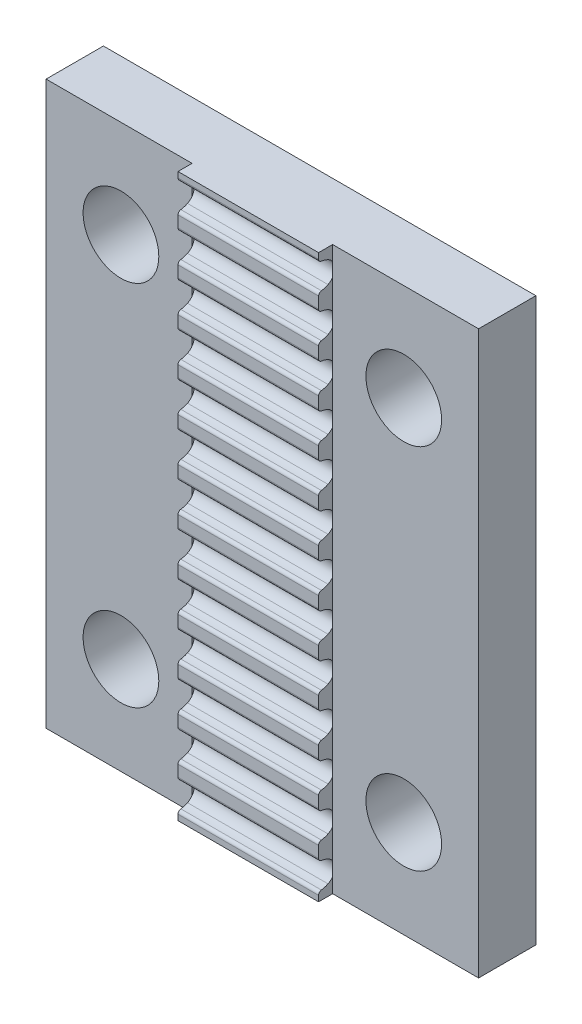
from build123d import *

# Parameters (mm, degrees)
SCHIZZO1_W                   = 6.75
SCHIZZO1_H                   = 26
SCHIZZO1_R                   = 1.75
SCHIZZO1_W_2                 = 6.5
ESTRUSIONE_ESTRUSIONE1_DEPTH = 1
SCHIZZO1_3_W                 = 6.5
SCHIZZO1_3_H                 = 26
ESTRUSIONE_ESTRUSIONE2_DEPTH = 1.65
ESTRUSIONE_ESTRUSIONE3_START = -1.65
SCHIZZO1_5_W                 = 6.75
SCHIZZO1_5_H                 = 26
SCHIZZO1_5_R                 = 1.75
SCHIZZO1_5_W_2               = 6.5
ESTRUSIONE_ESTRUSIONE3_DEPTH = 1.65
TAGLIO_ESTRUSIONE1_DEPTH     = 6.5


with BuildPart() as part:
    # Schizzo1 → Estrusione-Estrusione1 (new body)
    # profile 1 of 3: a face of its own
    with BuildSketch(Plane.XY):
        with Locations((-6.625, 0)):
            Rectangle(SCHIZZO1_W, SCHIZZO1_H)
        with Locations((-6.538461538, -8.5)):
            Circle(SCHIZZO1_R, mode=Mode.SUBTRACT)
        with Locations((-6.538461538, 8.5)):
            Circle(SCHIZZO1_R, mode=Mode.SUBTRACT)
    # profile 2 of 3: a face of its own
    with BuildSketch(Plane.XY):
        Rectangle(SCHIZZO1_W_2, SCHIZZO1_H)
    # profile 3 of 3: a face of its own
    with BuildSketch(Plane.XY):
        with Locations((6.625, 0)):
            Rectangle(SCHIZZO1_W, SCHIZZO1_H)
        with Locations((6.538461538, -8.5)):
            Circle(SCHIZZO1_R, mode=Mode.SUBTRACT)
        with Locations((6.538461538, 8.5)):
            Circle(SCHIZZO1_R, mode=Mode.SUBTRACT)
    extrude(amount=ESTRUSIONE_ESTRUSIONE1_DEPTH)

    # Schizzo1<3> → Estrusione-Estrusione2 (add)
    with BuildSketch(Plane.XY):
        Rectangle(SCHIZZO1_3_W, SCHIZZO1_3_H)
    extrude(amount=ESTRUSIONE_ESTRUSIONE2_DEPTH)

    # Schizzo1<5> → Estrusione-Estrusione3 (add)
    # profile 1 of 3: a face of its own
    with BuildSketch(Plane.XY.offset(ESTRUSIONE_ESTRUSIONE3_START)):
        with Locations((-6.625, 0)):
            Rectangle(SCHIZZO1_5_W, SCHIZZO1_5_H)
        with Locations((-6.538461538, -8.5)):
            Circle(SCHIZZO1_5_R, mode=Mode.SUBTRACT)
        with Locations((-6.538461538, 8.5)):
            Circle(SCHIZZO1_5_R, mode=Mode.SUBTRACT)
    # profile 2 of 3: a face of its own
    with BuildSketch(Plane.XY.offset(ESTRUSIONE_ESTRUSIONE3_START)):
        Rectangle(SCHIZZO1_5_W_2, SCHIZZO1_5_H)
    # profile 3 of 3: a face of its own
    with BuildSketch(Plane.XY.offset(ESTRUSIONE_ESTRUSIONE3_START)):
        with Locations((6.625, 0)):
            Rectangle(SCHIZZO1_5_W, SCHIZZO1_5_H)
        with Locations((6.538461538, -8.5)):
            Circle(SCHIZZO1_5_R, mode=Mode.SUBTRACT)
        with Locations((6.538461538, 8.5)):
            Circle(SCHIZZO1_5_R, mode=Mode.SUBTRACT)
    extrude(amount=ESTRUSIONE_ESTRUSIONE3_DEPTH)

    # Schizzo2 → Taglio-Estrusione1 (cut)
    with BuildSketch(Plane.ZY.offset(3.25)):
        with BuildLine():
            Line((1.65, 13), (1.65, 12.740175425))
            ThreePointArc((1.65, 12.740175425), (1.612771412, 12.641268354), (1.519565217, 12.591456891))
            ThreePointArc((1.519565217, 12.591456891), (1.361937846, 12.557611714), (1.211797753, 12.498876404))
            ThreePointArc((1.211797753, 12.498876404), (0.9, 12), (1.211797753, 11.501123596))
            ThreePointArc((1.211797753, 11.501123596), (1.361937846, 11.442388286), (1.519565217, 11.408543109))
            ThreePointArc((1.519565217, 11.408543109), (1.612771412, 11.358731646), (1.65, 11.259824575))
            Line((1.65, 11.259824575), (1.65, 11))
            Line((1.65, 11), (1.65, 10.740175425))
            ThreePointArc((1.65, 10.740175425), (1.612771412, 10.641268354), (1.519565217, 10.591456891))
            ThreePointArc((1.519565217, 10.591456891), (1.361937846, 10.557611714), (1.211797753, 10.498876404))
            ThreePointArc((1.211797753, 10.498876404), (0.9, 10), (1.211797753, 9.501123596))
            ThreePointArc((1.211797753, 9.501123596), (1.361937846, 9.442388286), (1.519565217, 9.408543109))
            ThreePointArc((1.519565217, 9.408543109), (1.612771412, 9.358731646), (1.65, 9.259824575))
            Line((1.65, 9.259824575), (1.65, 9))
            Line((1.65, 9), (1.65, 8.740175425))
            ThreePointArc((1.65, 8.740175425), (1.612771412, 8.641268354), (1.519565217, 8.591456891))
            ThreePointArc((1.519565217, 8.591456891), (1.361937846, 8.557611714), (1.211797753, 8.498876404))
            ThreePointArc((1.211797753, 8.498876404), (0.9, 8), (1.211797753, 7.501123596))
            ThreePointArc((1.211797753, 7.501123596), (1.361937846, 7.442388286), (1.519565217, 7.408543109))
            ThreePointArc((1.519565217, 7.408543109), (1.612771412, 7.358731646), (1.65, 7.259824575))
            Line((1.65, 7.259824575), (1.65, 7))
            Line((1.65, 7), (1.65, 6.740175425))
            ThreePointArc((1.65, 6.740175425), (1.612771412, 6.641268354), (1.519565217, 6.591456891))
            ThreePointArc((1.519565217, 6.591456891), (1.361937846, 6.557611714), (1.211797753, 6.498876404))
            ThreePointArc((1.211797753, 6.498876404), (0.9, 6), (1.211797753, 5.501123596))
            ThreePointArc((1.211797753, 5.501123596), (1.361937846, 5.442388286), (1.519565217, 5.408543109))
            ThreePointArc((1.519565217, 5.408543109), (1.612771412, 5.358731646), (1.65, 5.259824575))
            Line((1.65, 5.259824575), (1.65, 5))
            Line((1.65, 5), (1.65, 4.740175425))
            ThreePointArc((1.65, 4.740175425), (1.612771412, 4.641268354), (1.519565217, 4.591456891))
            ThreePointArc((1.519565217, 4.591456891), (1.361937846, 4.557611714), (1.211797753, 4.498876404))
            ThreePointArc((1.211797753, 4.498876404), (0.9, 4), (1.211797753, 3.501123596))
            ThreePointArc((1.211797753, 3.501123596), (1.361937846, 3.442388286), (1.519565217, 3.408543109))
            ThreePointArc((1.519565217, 3.408543109), (1.612771412, 3.358731646), (1.65, 3.259824575))
            Line((1.65, 3.259824575), (1.65, 3))
            Line((1.65, 3), (1.65, 2.740175425))
            ThreePointArc((1.65, 2.740175425), (1.612771412, 2.641268354), (1.519565217, 2.591456891))
            ThreePointArc((1.519565217, 2.591456891), (1.361937846, 2.557611714), (1.211797753, 2.498876404))
            ThreePointArc((1.211797753, 2.498876404), (0.9, 2), (1.211797753, 1.501123596))
            ThreePointArc((1.211797753, 1.501123596), (1.361937846, 1.442388286), (1.519565217, 1.408543109))
            ThreePointArc((1.519565217, 1.408543109), (1.612771412, 1.358731646), (1.65, 1.259824575))
            Line((1.65, 1.259824575), (1.65, 1))
            Line((1.65, 1), (1.65, 0.740175425))
            ThreePointArc((1.65, 0.740175425), (1.612771412, 0.641268354), (1.519565217, 0.591456891))
            ThreePointArc((1.519565217, 0.591456891), (1.361937846, 0.557611714), (1.211797753, 0.498876404))
            ThreePointArc((1.211797753, 0.498876404), (0.9, 0), (1.211797753, -0.498876404))
            ThreePointArc((1.211797753, -0.498876404), (1.361937846, -0.557611714), (1.519565217, -0.591456891))
            ThreePointArc((1.519565217, -0.591456891), (1.612771412, -0.641268354), (1.65, -0.740175425))
            Line((1.65, -0.740175425), (1.65, -1))
            Line((1.65, -1), (1.65, -1.259824575))
            ThreePointArc((1.65, -1.259824575), (1.612771412, -1.358731646), (1.519565217, -1.408543109))
            ThreePointArc((1.519565217, -1.408543109), (1.361937846, -1.442388286), (1.211797753, -1.501123596))
            ThreePointArc((1.211797753, -1.501123596), (0.9, -2), (1.211797753, -2.498876404))
            ThreePointArc((1.211797753, -2.498876404), (1.361937846, -2.557611714), (1.519565217, -2.591456891))
            ThreePointArc((1.519565217, -2.591456891), (1.612771412, -2.641268354), (1.65, -2.740175425))
            Line((1.65, -2.740175425), (1.65, -3))
            Line((1.65, -3), (1.65, -3.259824575))
            ThreePointArc((1.65, -3.259824575), (1.612771412, -3.358731646), (1.519565217, -3.408543109))
            ThreePointArc((1.519565217, -3.408543109), (1.361937846, -3.442388286), (1.211797753, -3.501123596))
            ThreePointArc((1.211797753, -3.501123596), (0.9, -4), (1.211797753, -4.498876404))
            ThreePointArc((1.211797753, -4.498876404), (1.361937846, -4.557611714), (1.519565217, -4.591456891))
            ThreePointArc((1.519565217, -4.591456891), (1.612771412, -4.641268354), (1.65, -4.740175425))
            Line((1.65, -4.740175425), (1.65, -5))
            Line((1.65, -5), (1.65, -5.259824575))
            ThreePointArc((1.65, -5.259824575), (1.612771412, -5.358731646), (1.519565217, -5.408543109))
            ThreePointArc((1.519565217, -5.408543109), (1.361937846, -5.442388286), (1.211797753, -5.501123596))
            ThreePointArc((1.211797753, -5.501123596), (0.9, -6), (1.211797753, -6.498876404))
            ThreePointArc((1.211797753, -6.498876404), (1.361937846, -6.557611714), (1.519565217, -6.591456891))
            ThreePointArc((1.519565217, -6.591456891), (1.612771412, -6.641268354), (1.65, -6.740175425))
            Line((1.65, -6.740175425), (1.65, -7))
            Line((1.65, -7), (1.65, -7.259824575))
            ThreePointArc((1.65, -7.259824575), (1.612771412, -7.358731646), (1.519565217, -7.408543109))
            ThreePointArc((1.519565217, -7.408543109), (1.361937846, -7.442388286), (1.211797753, -7.501123596))
            ThreePointArc((1.211797753, -7.501123596), (0.9, -8), (1.211797753, -8.498876404))
            ThreePointArc((1.211797753, -8.498876404), (1.361937846, -8.557611714), (1.519565217, -8.591456891))
            ThreePointArc((1.519565217, -8.591456891), (1.612771412, -8.641268354), (1.65, -8.740175425))
            Line((1.65, -8.740175425), (1.65, -9))
            Line((1.65, -9), (1.65, -9.259824575))
            ThreePointArc((1.65, -9.259824575), (1.612771412, -9.358731646), (1.519565217, -9.408543109))
            ThreePointArc((1.519565217, -9.408543109), (1.361937846, -9.442388286), (1.211797753, -9.501123596))
            ThreePointArc((1.211797753, -9.501123596), (0.9, -10), (1.211797753, -10.498876404))
            ThreePointArc((1.211797753, -10.498876404), (1.361937846, -10.557611714), (1.519565217, -10.591456891))
            ThreePointArc((1.519565217, -10.591456891), (1.612771412, -10.641268354), (1.65, -10.740175425))
            Line((1.65, -10.740175425), (1.65, -11))
            Line((1.65, -11), (1.65, -11.259824575))
            ThreePointArc((1.65, -11.259824575), (1.612771412, -11.358731646), (1.519565217, -11.408543109))
            ThreePointArc((1.519565217, -11.408543109), (1.361937846, -11.442388286), (1.211797753, -11.501123596))
            ThreePointArc((1.211797753, -11.501123596), (0.9, -12), (1.211797753, -12.498876404))
            ThreePointArc((1.211797753, -12.498876404), (1.361937846, -12.557611714), (1.519565217, -12.591456891))
            ThreePointArc((1.519565217, -12.591456891), (1.612771412, -12.641268354), (1.65, -12.740175425))
            Line((1.65, -12.740175425), (1.65, -13))
            Line((1.65, -13), (2.28, -13))
            Line((2.28, -13), (2.28, -11))
            Line((2.28, -11), (2.28, -9))
            Line((2.28, -9), (2.28, -7))
            Line((2.28, -7), (2.28, -5))
            Line((2.28, -5), (2.28, -3))
            Line((2.28, -3), (2.28, -1))
            Line((2.28, -1), (2.28, 1))
            Line((2.28, 1), (2.28, 3))
            Line((2.28, 3), (2.28, 5))
            Line((2.28, 5), (2.28, 7))
            Line((2.28, 7), (2.28, 9))
            Line((2.28, 9), (2.28, 11))
            Line((2.28, 11), (2.28, 13))
            Line((2.28, 13), (1.65, 13))
        make_face()
    extrude(amount=-TAGLIO_ESTRUSIONE1_DEPTH, mode=Mode.SUBTRACT)


solid = part.part
